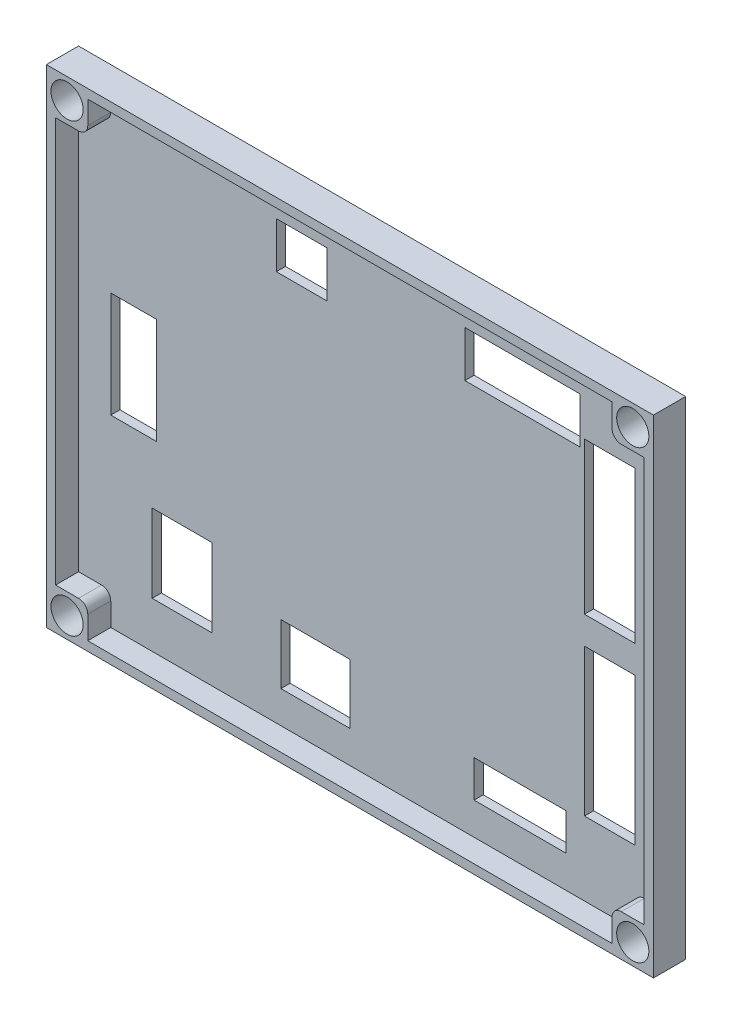
from build123d import *

# Parameters (mm, degrees)
BOSS_EXTRU_1_DEPTH      = 2
ESQUISSE1_3_W           = 132
ESQUISSE1_3_H           = 106
BOSS_EXTRU_2_DEPTH      = 7
ENL_V_START             = 7
ESQUISSE1_4_R           = 3.5
ENL_V_MAT_EXTRU_1_DEPTH = 5
CONG_2_R                = 2
ESQUISSE2_W             = 11
ESQUISSE2_H             = 33
ESQUISSE2_H_2           = 32
ESQUISSE2_W_2           = 25
ESQUISSE2_H_3           = 10
ESQUISSE2_W_3           = 20
ESQUISSE2_H_4           = 8
ESQUISSE2_W_4           = 10
ESQUISSE2_H_5           = 23
ESQUISSE2_W_5           = 15
ESQUISSE2_H_6           = 13
ESQUISSE2_W_6           = 13
ESQUISSE2_H_7           = 17
ENL_V_MAT_EXTRU_2_DEPTH = 170.437304039
ENL_V_MAT_EXTRU_3_DEPTH = 1


with BuildPart() as part:
    # Esquisse1 → Boss.-Extru.1 (new body)
    with BuildSketch(Plane.XY):
        Polygon((9, 2), (123, 2), (123, 9), (130, 9), (130, 97), (123, 97), (123, 104), (9, 104), (9, 97), (2, 97), (2, 9), (9, 9), align=None)
    extrude(amount=BOSS_EXTRU_1_DEPTH)

    # Esquisse1<3> → Boss.-Extru.2 (add)
    with BuildSketch(Plane.XY):
        with Locations((66, 53)):
            Rectangle(ESQUISSE1_3_W, ESQUISSE1_3_H)
        Polygon((123, 2), (9, 2), (9, 9), (2, 9), (2, 97), (9, 97), (9, 104), (123, 104), (123, 97), (130, 97), (130, 9), (123, 9), align=None, mode=Mode.SUBTRACT)
    extrude(amount=BOSS_EXTRU_2_DEPTH)

    # Esquisse1<4> → Enlèv. mat.-Extru.1 (cut)
    with BuildSketch(Plane.XY.offset(ENL_V_START)):
        with Locations((127.5, 4.5)):
            Circle(ESQUISSE1_4_R)
        with Locations((4.5, 4.5)):
            Circle(ESQUISSE1_4_R)
        with Locations((127.5, 101.5)):
            Circle(ESQUISSE1_4_R)
        with Locations((4.5, 101.5)):
            Circle(ESQUISSE1_4_R)
    extrude(amount=-ENL_V_MAT_EXTRU_1_DEPTH, mode=Mode.SUBTRACT)

    # Congé2
    cong_2_edges = [part.edges().sort_by_distance(p)[0] for p in [
        (123, 9, 4.5),
        (9, 9, 4.5),
        (123, 97, 4.5),
        (9, 97, 4.5),
    ]]
    fillet(cong_2_edges, radius=CONG_2_R)

    # Esquisse2 → Enlèv. mat.-Extru.2 (cut, through all)
    with BuildSketch(Plane(origin=(0, 0, 0), x_dir=(-1, 0, 0), z_dir=(0, 0, -1))):
        with Locations((-117.5, 72.5)):
            Rectangle(ESQUISSE2_W, ESQUISSE2_H)
        with Locations((-117.5, 34)):
            Rectangle(ESQUISSE2_W, ESQUISSE2_H_2)
        with Locations((-98.5, 92)):
            Rectangle(ESQUISSE2_W_2, ESQUISSE2_H_3)
        with Locations((-50.5, 92)):
            Rectangle(ESQUISSE2_W, ESQUISSE2_H_3)
        with Locations((-98, 13)):
            Rectangle(ESQUISSE2_W_3, ESQUISSE2_H_4)
        with Locations((-14, 53.5)):
            Rectangle(ESQUISSE2_W_4, ESQUISSE2_H_5)
        with Locations((-53.5, 15.5)):
            Rectangle(ESQUISSE2_W_5, ESQUISSE2_H_6)
        with Locations((-24.5, 20.5)):
            Rectangle(ESQUISSE2_W_6, ESQUISSE2_H_7)
    extrude(amount=-ENL_V_MAT_EXTRU_2_DEPTH, mode=Mode.SUBTRACT)

    # Esquisse3 → Enlèv. mat.-Extru.3 (cut)
    with BuildSketch(Plane(origin=(0, 0, 0), x_dir=(-1, 0, 0), z_dir=(0, 0, -1))):
        Polygon((-107.459781868, 44.698192836), (-104.258069127, 63.748192836), (-103.643676099, 63.748192836), (-94.637666483, 48.117423605), (-85.643105185, 63.748192836), (-85.021079945, 63.748192836), (-81.815551099, 44.698192836), (-84.032708551, 44.698192836), (-86.333820329, 58.375115913), (-94.202630426, 44.698192836), (-95.065070329, 44.698192836), (-102.941512637, 58.375115913), (-105.23880831, 44.698192836), align=None)
        with BuildLine():
            Line((-72.485935714, 48.373102692), (-70.577882829, 49.338577451))
            add(Edge.make_bspline(
                [(-70.577882829, 49.338577451), (-70.405523019, 49.087200629), (-70.073356618, 48.602755128), (-69.520728406, 47.955227706), (-68.951563674, 47.402047203), (-68.357645718, 46.953069209), (-67.744486974, 46.596525994), (-67.107089048, 46.349048302), (-66.448861209, 46.191277009), (-66.001977487, 46.172846761), (-65.777221772, 46.163577451)],
                knots=[0, 0, 0, 0, 1.216676279, 2.34474023, 3.393999932, 4.380676408, 5.311457157, 6.217204888, 7.103360962, 8, 8, 8, 8], degree=3))
            add(Edge.make_bspline(
                [(-65.777221772, 46.163577451), (-65.586081829, 46.168253886), (-65.207003257, 46.177528431), (-64.648569432, 46.265599674), (-64.106714231, 46.401175206), (-63.59225451, 46.596079828), (-63.112458517, 46.832111407), (-62.68764971, 47.114137449), (-62.322458097, 47.433634111), (-62.023524236, 47.789583703), (-61.791017613, 48.17188815), (-61.620280792, 48.566891296), (-61.515791471, 48.975797503), (-61.50232265, 49.252758632), (-61.495551099, 49.392002932)],
                knots=[0, 0, 0, 0, 1.157831267, 2.296270561, 3.418324794, 4.538257639, 5.624451095, 6.653071252, 7.619961004, 8.555856215, 9.459036632, 10.322645241, 11.156697225, 12, 12, 12, 12], degree=3))
            add(Edge.make_bspline(
                [(-61.495551099, 49.392002932), (-61.505783508, 49.550766328), (-61.526659689, 49.874675707), (-61.679851426, 50.353085318), (-61.93016848, 50.824440403), (-62.158279382, 51.111448207), (-62.277852781, 51.261894759)],
                knots=[0, 0, 0, 0, 0.920049701, 1.877087126, 2.887190807, 4, 4, 4, 4], degree=3))
            add(Edge.make_bspline(
                [(-62.277852781, 51.261894759), (-62.375606487, 51.371425885), (-62.582434325, 51.603172456), (-62.940491053, 51.939623254), (-63.350779549, 52.295528369), (-63.814689863, 52.668236681), (-64.337400198, 53.053463066), (-64.912925668, 53.458102609), (-65.546225973, 53.876674291), (-65.990334311, 54.155429047), (-66.219890041, 54.299514951)],
                knots=[0, 0, 0, 0, 0.705358151, 1.492400735, 2.359189749, 3.315973156, 4.351723833, 5.479732962, 6.697295928, 8, 8, 8, 8], degree=3))
            add(Edge.make_bspline(
                [(-66.219890041, 54.299514951), (-66.449680752, 54.441971829), (-66.887888182, 54.713634952), (-67.500973214, 55.121671242), (-68.052048385, 55.489057917), (-68.533559988, 55.829793857), (-68.948530326, 56.135928251), (-69.295768016, 56.412179481), (-69.575365043, 56.65637759), (-69.730364008, 56.818461873), (-69.799397252, 56.890650769)],
                knots=[0, 0, 0, 0, 1.465128484, 2.793977977, 3.990892448, 5.054341232, 5.990521499, 6.785069076, 7.458895584, 8, 8, 8, 8], degree=3))
            add(Edge.make_bspline(
                [(-69.799397252, 56.890650769), (-69.896594998, 57.002408753), (-70.086506488, 57.220769016), (-70.335682843, 57.566539814), (-70.548510562, 57.919181454), (-70.718204973, 58.280737386), (-70.855680711, 58.647595789), (-70.950015651, 59.022601123), (-71.009564203, 59.404828365), (-71.01688874, 59.66220146), (-71.020551099, 59.790891153)],
                knots=[0, 0, 0, 0, 1.102760263, 2.154647138, 3.170233095, 4.166227071, 5.125489655, 6.083769076, 7.041861113, 8, 8, 8, 8], degree=3))
            add(Edge.make_bspline(
                [(-71.020551099, 59.790891153), (-71.011613469, 59.992606545), (-70.993877952, 60.392883465), (-70.855746723, 60.977836581), (-70.631148074, 61.534362784), (-70.321429129, 62.059486683), (-69.924464935, 62.538182304), (-69.461628883, 62.976793239), (-68.914084474, 63.3439186), (-68.310597708, 63.665274098), (-67.65305977, 63.915496158), (-66.962914019, 64.107308291), (-66.242216115, 64.212741856), (-65.753364784, 64.228625896), (-65.506278262, 64.236654375)],
                knots=[0, 0, 0, 0, 0.921026827, 1.827653203, 2.730002619, 3.655092255, 4.601037958, 5.563360675, 6.558138066, 7.603378216, 8.681726461, 9.76605798, 10.870869466, 12, 12, 12, 12], degree=3))
            add(Edge.make_bspline(
                [(-65.506278262, 64.236654375), (-65.24242449, 64.229079147), (-64.720346357, 64.214090312), (-63.95040801, 64.079184007), (-63.208272937, 63.86112539), (-62.609630185, 63.609513508), (-62.143055186, 63.354535895), (-61.783230388, 63.130063998), (-61.421879581, 62.863389549), (-61.050337915, 62.568195854), (-60.681731604, 62.228132128), (-60.302256575, 61.859166605), (-59.921809157, 61.449168415), (-59.670635519, 61.160316372), (-59.541704945, 61.012045)],
                knots=[0, 0, 0, 0, 1.350062721, 2.671321385, 3.988222816, 5.304350983, 5.986306084, 6.709115396, 7.473814191, 8.284474723, 9.137459562, 10.040141913, 10.993980293, 12, 12, 12, 12], degree=3))
            Line((-59.541704945, 61.012045), (-61.373435714, 59.840500528))
            add(Edge.make_bspline(
                [(-61.373435714, 59.840500528), (-61.479181025, 59.961094069), (-61.683996612, 60.19466884), (-61.998779948, 60.516422843), (-62.29450347, 60.812526456), (-62.581887245, 61.072601841), (-62.856208641, 61.300976586), (-63.116420111, 61.502534022), (-63.366131528, 61.670029111), (-63.683603828, 61.848643713), (-64.081957134, 62.025345905), (-64.579124146, 62.175460095), (-65.09728257, 62.264719499), (-65.449964109, 62.27673122), (-65.628393647, 62.282808221)],
                knots=[0, 0, 0, 0, 1.135326257, 2.198986534, 3.186077421, 4.097819817, 4.941888073, 5.712834383, 6.427208581, 7.068407158, 8.290072114, 9.503777389, 10.737104731, 12, 12, 12, 12], degree=3))
            add(Edge.make_bspline(
                [(-65.628393647, 62.282808221), (-65.853092289, 62.276323053), (-66.285240864, 62.263850545), (-66.900307056, 62.124600742), (-67.455091489, 61.910805879), (-67.858010247, 61.650084536), (-68.138616575, 61.412497037), (-68.319681786, 61.221919247), (-68.479269322, 61.026407091), (-68.600139595, 60.811289601), (-68.701719714, 60.591686069), (-68.769797853, 60.358847284), (-68.813101984, 60.118146001), (-68.819331292, 59.953897793), (-68.822474176, 59.871029375)],
                knots=[0, 0, 0, 0, 1.813496982, 3.487783141, 5.070901692, 6.597116099, 7.341118693, 8.039364044, 8.720356639, 9.374738841, 10.028393367, 10.672595398, 11.330282378, 12, 12, 12, 12], degree=3))
            add(Edge.make_bspline(
                [(-68.822474176, 59.871029375), (-68.818700667, 59.769035742), (-68.811141628, 59.564723567), (-68.75262816, 59.25999392), (-68.650072112, 58.96218066), (-68.516348261, 58.660402081), (-68.32341994, 58.357606021), (-68.067769686, 58.049952796), (-67.752204782, 57.727362478), (-67.511443582, 57.519722815), (-67.383802301, 57.409641153)],
                knots=[0, 0, 0, 0, 0.828687681, 1.660015219, 2.510032323, 3.384469844, 4.336784, 5.416988475, 6.630597858, 8, 8, 8, 8], degree=3))
            add(Edge.make_bspline(
                [(-67.383802301, 57.409641153), (-67.335726036, 57.372401252), (-67.221240172, 57.28372044), (-67.013354505, 57.139140191), (-66.739904415, 56.960999427), (-66.406506711, 56.738477253), (-66.005681116, 56.484921264), (-65.542450767, 56.193963646), (-65.015771157, 55.865858038), (-64.642634305, 55.635041871), (-64.445400858, 55.513036586)],
                knots=[0, 0, 0, 0, 0.417144128, 0.993361405, 1.736401134, 2.656132436, 3.74307082, 4.989991984, 6.40896376, 8, 8, 8, 8], degree=3))
            add(Edge.make_bspline(
                [(-64.445400858, 55.513036586), (-64.208140254, 55.362693373), (-63.749454055, 55.072041003), (-63.09603916, 54.634479511), (-62.503012858, 54.206631913), (-61.969094885, 53.790857209), (-61.489501965, 53.391028973), (-61.068919965, 53.00158926), (-60.70332938, 52.626131991), (-60.399926981, 52.253367312), (-60.135821573, 51.893218831), (-59.915322942, 51.531308489), (-59.72101386, 51.174405996), (-59.570284228, 50.81247854), (-59.443267522, 50.453346564), (-59.363599266, 50.090300715), (-59.303958421, 49.728506773), (-59.29963595, 49.486382481), (-59.297474176, 49.365290192)],
                knots=[0, 0, 0, 0, 1.611480125, 3.115408465, 4.511015044, 5.805898628, 6.997291706, 8.092095579, 9.093444635, 10.000782571, 10.847481471, 11.653576756, 12.430604247, 13.176148627, 13.90082637, 14.612488554, 15.306071539, 16, 16, 16, 16], degree=3))
            add(Edge.make_bspline(
                [(-59.297474176, 49.365290192), (-59.304060854, 49.194571788), (-59.317116932, 48.85617472), (-59.399731433, 48.355923504), (-59.553758039, 47.876610889), (-59.755098675, 47.409667817), (-60.022153322, 46.964337389), (-60.339752372, 46.530674364), (-60.726662699, 46.125638529), (-61.156382565, 45.734349556), (-61.630894763, 45.378737347), (-62.134757273, 45.064938081), (-62.664531511, 44.799379754), (-63.221128089, 44.585923933), (-63.802204891, 44.418362815), (-64.408117879, 44.295602474), (-65.038864572, 44.221669923), (-65.467918, 44.213750102), (-65.685635233, 44.209731298)],
                knots=[0, 0, 0, 0, 0.901451134, 1.786851409, 2.6661699, 3.553249336, 4.465392444, 5.401519336, 6.38500565, 7.416737407, 8.467009679, 9.510540737, 10.546634094, 11.590446006, 12.653075726, 13.735633854, 14.850978692, 16, 16, 16, 16], degree=3))
            add(Edge.make_bspline(
                [(-65.685635233, 44.209731298), (-65.854937134, 44.212501968), (-66.190350508, 44.217991097), (-66.685777985, 44.266612029), (-67.170941307, 44.336574319), (-67.64183792, 44.445189746), (-68.103546037, 44.578908472), (-68.552925031, 44.742007442), (-68.989795464, 44.938207068), (-69.41518063, 45.163683042), (-69.831061311, 45.42463493), (-70.234755297, 45.728157267), (-70.633708926, 46.06848103), (-71.021352824, 46.45193322), (-71.405243731, 46.871197428), (-71.77266825, 47.336937116), (-72.142563528, 47.834621865), (-72.369805817, 48.190986244), (-72.485935714, 48.373102692)],
                knots=[0, 0, 0, 0, 0.970007308, 1.921735215, 2.850658685, 3.777376943, 4.68862592, 5.604180401, 6.514612533, 7.43100829, 8.361389479, 9.325130809, 10.323007939, 11.364329111, 12.448064306, 13.578600788, 14.762568177, 16, 16, 16, 16], degree=3))
        make_face()
        with BuildLine():
            Line((-26.277474176, 60.252639951), (-28.048147252, 59.107808221))
            add(Edge.make_bspline(
                [(-28.048147252, 59.107808221), (-28.171351994, 59.235221116), (-28.41729393, 59.48956339), (-28.811956768, 59.844211003), (-29.224415217, 60.175258256), (-29.652061047, 60.487989234), (-30.103500261, 60.76762501), (-30.570065515, 61.02899219), (-31.0556417, 61.265588148), (-31.559178888, 61.478478657), (-32.07708566, 61.669500198), (-32.608274844, 61.833867287), (-33.152578579, 61.970584507), (-33.708660558, 62.086068472), (-34.278331444, 62.172242347), (-34.85989747, 62.238274804), (-35.454670884, 62.277064521), (-35.855844086, 62.280882724), (-36.058153262, 62.282808221)],
                knots=[0, 0, 0, 0, 0.959193208, 1.914746389, 2.869679137, 3.821428933, 4.780498557, 5.742234052, 6.715364188, 7.702690763, 8.700431152, 9.702297295, 10.711002194, 11.737320806, 12.775444227, 13.828599076, 14.904975879, 16, 16, 16, 16], degree=3))
            add(Edge.make_bspline(
                [(-36.058153262, 62.282808221), (-36.279613567, 62.280617298), (-36.719386418, 62.276266595), (-37.371270003, 62.218817156), (-38.011002539, 62.136700776), (-38.637971665, 62.018254966), (-39.252506301, 61.863998083), (-39.85804237, 61.683058672), (-40.447713827, 61.45960252), (-41.023452404, 61.210012857), (-41.57428009, 60.92782502), (-42.098266054, 60.622623614), (-42.591055103, 60.295047698), (-43.050702172, 59.94387621), (-43.475317203, 59.566444011), (-43.874791215, 59.171471171), (-44.235641367, 58.74687822), (-44.565178761, 58.303591659), (-44.858932315, 57.842158232), (-45.115606302, 57.36574528), (-45.329894141, 56.872175355), (-45.509937993, 56.366736213), (-45.648204924, 55.845962191), (-45.741328418, 55.3107692), (-45.806435699, 54.762861547), (-45.812753183, 54.391294815), (-45.815935714, 54.204112307)],
                knots=[0, 0, 0, 0, 1.130313612, 2.244561341, 3.338486505, 4.422418799, 5.499794283, 6.572206187, 7.646994837, 8.717221779, 9.774443591, 10.804753708, 11.811627682, 12.793626781, 13.755249653, 14.710425475, 15.659266024, 16.59706303, 17.528497121, 18.449549241, 19.356899339, 20.272992618, 21.186642547, 22.103840107, 23.044780023, 24, 24, 24, 24], degree=3))
            add(Edge.make_bspline(
                [(-45.815935714, 54.204112307), (-45.806769238, 53.922516661), (-45.788751206, 53.368999755), (-45.657200684, 52.556271246), (-45.434075625, 51.782420862), (-45.126846332, 51.040836393), (-44.726897334, 50.338118794), (-44.241996005, 49.667586786), (-43.665672811, 49.038612428), (-43.011356203, 48.449470371), (-42.289661216, 47.915880104), (-41.517807853, 47.442724518), (-40.695082604, 47.050309362), (-39.830021386, 46.724253076), (-38.916724377, 46.471645311), (-37.957527442, 46.296386029), (-36.953976134, 46.180039792), (-36.269648612, 46.169136188), (-35.920773454, 46.163577451)],
                knots=[0, 0, 0, 0, 0.950386027, 1.86812098, 2.770569326, 3.663734584, 4.571317233, 5.493811656, 6.451349357, 7.445580447, 8.461568994, 9.477121877, 10.496950714, 11.533778168, 12.594333677, 13.690876474, 14.822792001, 16, 16, 16, 16], degree=3))
            add(Edge.make_bspline(
                [(-35.920773454, 46.163577451), (-35.726076365, 46.165334384), (-35.341382284, 46.168805836), (-34.771139611, 46.209795666), (-34.213016662, 46.26858846), (-33.667167557, 46.358184393), (-33.131591431, 46.467007585), (-32.608949457, 46.606316058), (-32.096891202, 46.764096426), (-31.599347957, 46.954688072), (-31.110739993, 47.161388052), (-30.637426244, 47.40077768), (-30.17361685, 47.659290946), (-29.72443847, 47.947241607), (-29.283651514, 48.254434667), (-28.861058141, 48.594448806), (-28.442516558, 48.94957969), (-28.180134398, 49.208388049), (-28.048147252, 49.338577451)],
                knots=[0, 0, 0, 0, 1.070808156, 2.115766403, 3.143503364, 4.156991828, 5.157424436, 6.148613157, 7.131243622, 8.103378835, 9.078230077, 10.048323279, 11.019551461, 11.99791226, 12.982185712, 13.973374433, 14.980538453, 16, 16, 16, 16], degree=3))
            Line((-28.048147252, 49.338577451), (-26.277474176, 48.205194038))
            add(Edge.make_bspline(
                [(-26.277474176, 48.205194038), (-26.418232539, 48.049653887), (-26.700268676, 47.737999629), (-27.154318815, 47.299750206), (-27.6368284, 46.890218454), (-28.146204074, 46.509992863), (-28.675549198, 46.148499546), (-29.235297816, 45.821073583), (-29.819914544, 45.519012101), (-30.429000299, 45.245584367), (-31.058783797, 45.000089241), (-31.709310824, 44.791093093), (-32.376820473, 44.612336079), (-33.062706306, 44.461696305), (-33.767346226, 44.348111726), (-34.489628984, 44.269744941), (-35.229273969, 44.21704409), (-35.728602675, 44.212191984), (-35.981831147, 44.209731298)],
                knots=[0, 0, 0, 0, 0.929852963, 1.86313716, 2.795381373, 3.733814318, 4.680144738, 5.635756163, 6.606851702, 7.596343357, 8.594428107, 9.60209053, 10.623997844, 11.657171983, 12.714130097, 13.786577079, 14.877489523, 16, 16, 16, 16], degree=3))
            add(Edge.make_bspline(
                [(-35.981831147, 44.209731298), (-36.222327455, 44.211100182), (-36.696076186, 44.213796719), (-37.397183229, 44.260041058), (-38.078673906, 44.321470763), (-38.741356843, 44.416011041), (-39.385680178, 44.526185806), (-40.008407553, 44.674586785), (-40.612902069, 44.840529552), (-41.198387246, 45.036631081), (-41.765989949, 45.256216515), (-42.313566765, 45.505269796), (-42.839924788, 45.780918588), (-43.349337342, 46.078238153), (-43.838522262, 46.403275835), (-44.308327911, 46.755192483), (-44.760543816, 47.132363422), (-45.044089549, 47.404649341), (-45.186278262, 47.541191634)],
                knots=[0, 0, 0, 0, 1.148145954, 2.261709096, 3.353861998, 4.414741617, 5.45730948, 6.473933583, 7.470156968, 8.449761459, 9.420949867, 10.375064094, 11.320515853, 12.257047779, 13.190343743, 14.123323402, 15.058909376, 16, 16, 16, 16], degree=3))
            add(Edge.make_bspline(
                [(-45.186278262, 47.541191634), (-45.412917267, 47.777024964), (-45.859403934, 48.241624771), (-46.429781198, 49.009509181), (-46.925039224, 49.803974458), (-47.321883886, 50.641122324), (-47.633661995, 51.512750374), (-47.854997728, 52.420561037), (-47.986746319, 53.365788052), (-48.004828992, 54.007800899), (-48.014012637, 54.333859903)],
                knots=[0, 0, 0, 0, 1.037190413, 2.043300942, 3.029340503, 4.00450888, 4.977585605, 5.962674178, 6.965303527, 8, 8, 8, 8], degree=3))
            add(Edge.make_bspline(
                [(-48.014012637, 54.333859903), (-48.010383142, 54.50689977), (-48.003195733, 54.849566748), (-47.966988459, 55.358391791), (-47.894843501, 55.855639784), (-47.807120445, 56.34489602), (-47.681478463, 56.821231573), (-47.53963565, 57.289509809), (-47.359912934, 57.74321938), (-47.164708634, 58.191886081), (-46.932998673, 58.625212377), (-46.681199994, 59.052424158), (-46.398633544, 59.46728546), (-46.08853515, 59.870817179), (-45.75676332, 60.267299919), (-45.391573672, 60.646137922), (-45.00723555, 61.023440076), (-44.452768651, 61.502336363), (-43.72163135, 62.064758836), (-42.778542236, 62.646195151), (-41.780174232, 63.13501471), (-40.731753526, 63.542180609), (-39.627703626, 63.855182181), (-38.470557396, 64.073812979), (-37.259709781, 64.211031333), (-36.433777582, 64.227997621), (-36.012359993, 64.236654375)],
                knots=[0, 0, 0, 0, 0.718650565, 1.423127645, 2.116326935, 2.804193222, 3.485723535, 4.160651769, 4.834525121, 5.510795429, 6.191240094, 6.87334326, 7.56921377, 8.27384924, 8.985987223, 9.714527276, 10.457851907, 11.22155856, 12.755469605, 14.282846379, 15.813543898, 17.365311537, 18.946959557, 20.571248182, 22.250538814, 24, 24, 24, 24], degree=3))
            add(Edge.make_bspline(
                [(-36.012359993, 64.236654375), (-35.755326324, 64.23409232), (-35.248394663, 64.229039339), (-34.49703382, 64.177761959), (-33.76617972, 64.094350573), (-33.053321281, 63.978673928), (-32.357875054, 63.836625534), (-31.683623482, 63.651844643), (-31.028022061, 63.437094059), (-30.391739979, 63.194259148), (-29.778967769, 62.92032509), (-29.192934379, 62.618236205), (-28.63630422, 62.288747004), (-28.102676521, 61.939700166), (-27.604380031, 61.556327705), (-27.131135392, 61.150588999), (-26.68873898, 60.715841548), (-26.414414182, 60.406873499), (-26.277474176, 60.252639951)],
                knots=[0, 0, 0, 0, 1.13630918, 2.241072553, 3.327982818, 4.387601783, 5.433277787, 6.464715053, 7.476709939, 8.482559875, 9.474476383, 10.442915591, 11.395913039, 12.333399956, 13.260299979, 14.173516801, 15.088239112, 16, 16, 16, 16], degree=3))
        make_face()
    extrude(amount=-ENL_V_MAT_EXTRU_3_DEPTH, mode=Mode.SUBTRACT)


solid = part.part
